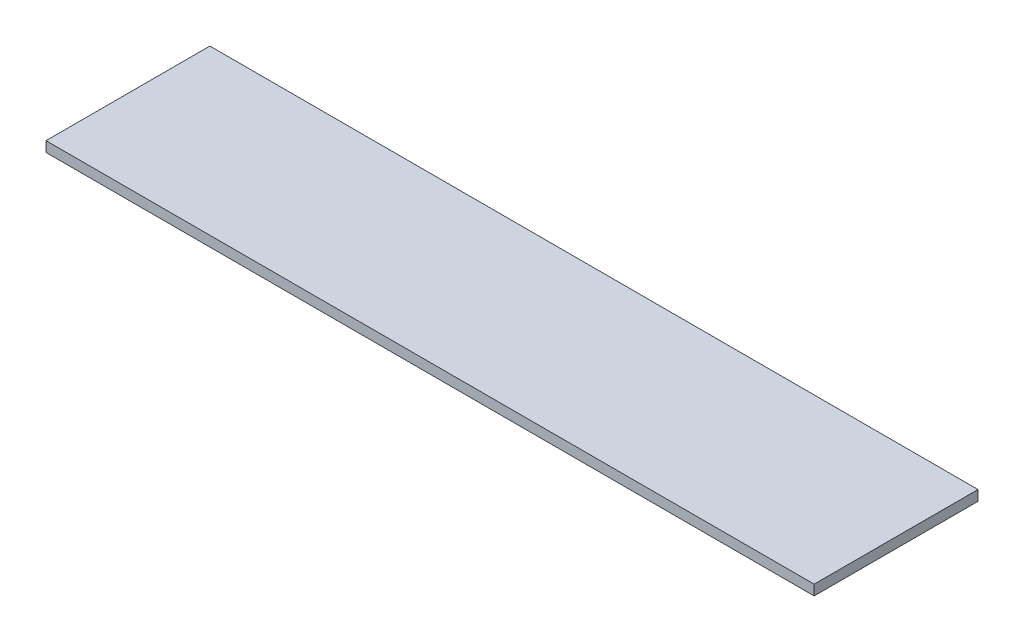
from build123d import *

# Parameters (mm, degrees)
SKETCH1_W           = 150
SKETCH1_H           = 32
BOSS_EXTRUDE1_DEPTH = 2


with BuildPart() as part:
    # Sketch1 → Boss-Extrude1 (new body)
    with BuildSketch(Plane(origin=(0, 0, 0), x_dir=(1, 0, 0), z_dir=(0, 1, 0))):
        with Locations((75, 16)):
            Rectangle(SKETCH1_W, SKETCH1_H)
    extrude(amount=BOSS_EXTRUDE1_DEPTH)


solid = part.part
